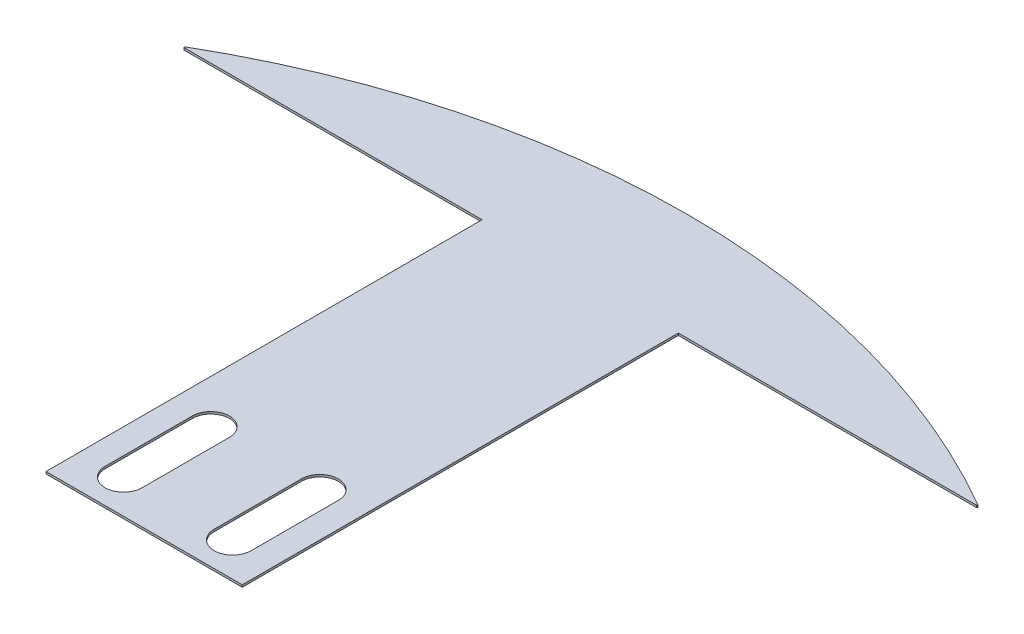
from build123d import *

# Parameters (mm, degrees)
BOSS_EXTRUDE1_DEPTH = 0.25


with BuildPart() as part:
    # Sketch1 → Boss-Extrude1 (new, symmetric)
    with BuildSketch(Plane(origin=(0, 0, 0), x_dir=(1, 0, 0), z_dir=(0, 1, 0))):
        with BuildLine():
            Line((-22.5, 57.39480496), (22.5, 57.39480496))
            Line((22.5, 57.39480496), (22.5, 157.39480496))
            Line((22.5, 157.39480496), (90.871933013, 157.39480496))
            Line((90.871933013, 157.39480496), (91, 157.616623489))
            ThreePointArc((91, 157.616623489), (0, 182), (-91, 157.616623489))
            Line((-91, 157.616623489), (-90.871933013, 157.39480496))
            Line((-90.871933013, 157.39480496), (-22.5, 157.39480496))
            Line((-22.5, 157.39480496), (-22.5, 57.39480496))
        make_face()
        with BuildLine():
            Line((-16.75, 85.19480496), (-16.75, 65.19480496))
            ThreePointArc((-16.75, 65.19480496), (-12.5, 60.94480496), (-8.25, 65.19480496))
            Line((-8.25, 65.19480496), (-8.25, 85.19480496))
            ThreePointArc((-8.25, 85.19480496), (-12.5, 89.44480496), (-16.75, 85.19480496))
        make_face(mode=Mode.SUBTRACT)
        with BuildLine():
            Line((16.75, 85.19480496), (16.75, 65.19480496))
            ThreePointArc((16.75, 65.19480496), (12.5, 60.94480496), (8.25, 65.19480496))
            Line((8.25, 65.19480496), (8.25, 85.19480496))
            ThreePointArc((8.25, 85.19480496), (12.5, 89.44480496), (16.75, 85.19480496))
        make_face(mode=Mode.SUBTRACT)
    extrude(amount=BOSS_EXTRUDE1_DEPTH, both=True)


solid = part.part
